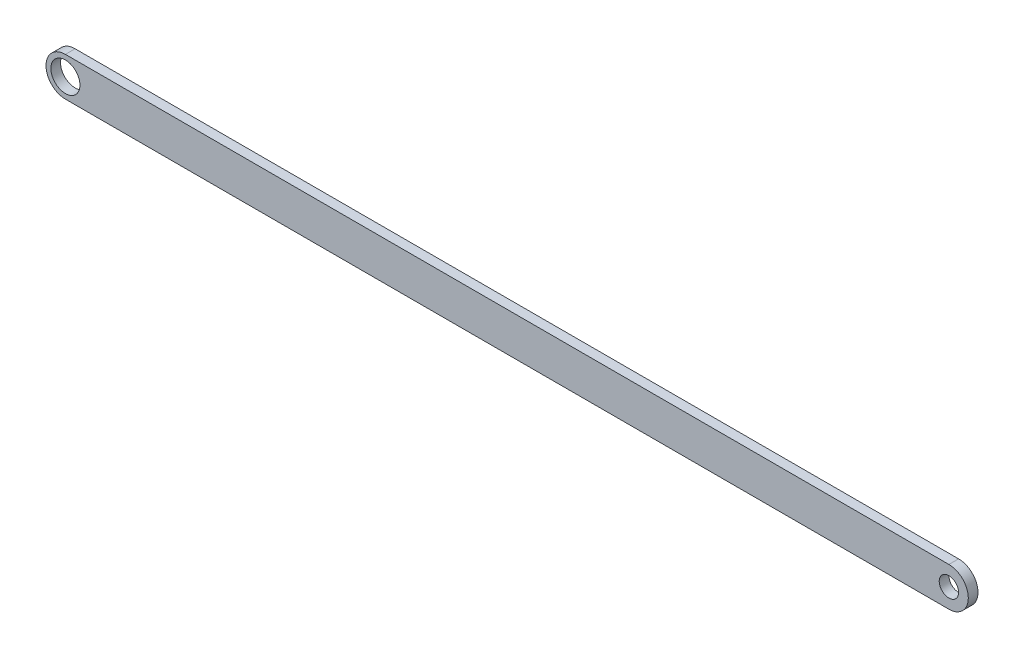
from build123d import *

# Parameters (mm, degrees)
ESBO_O1_R                = 1.5
ESBO_O1_R_2              = 1
RESSALTO_EXTRUS_O1_DEPTH = 1


with BuildPart() as part:
    # Esboço1 → Ressalto-extrusão1 (new body)
    with BuildSketch(Plane.XY):
        with BuildLine():
            Line((-45.545, 2), (45.545, 2))
            ThreePointArc((45.545, 2), (47.545, 0), (45.545, -2))
            Line((45.545, -2), (-45.545, -2))
            ThreePointArc((-45.545, -2), (-47.545, 0), (-45.545, 2))
        make_face()
        with Locations((-45.545, 0)):
            Circle(ESBO_O1_R, mode=Mode.SUBTRACT)
        with Locations((45.545, 0)):
            Circle(ESBO_O1_R_2, mode=Mode.SUBTRACT)
    extrude(amount=RESSALTO_EXTRUS_O1_DEPTH)


solid = part.part
